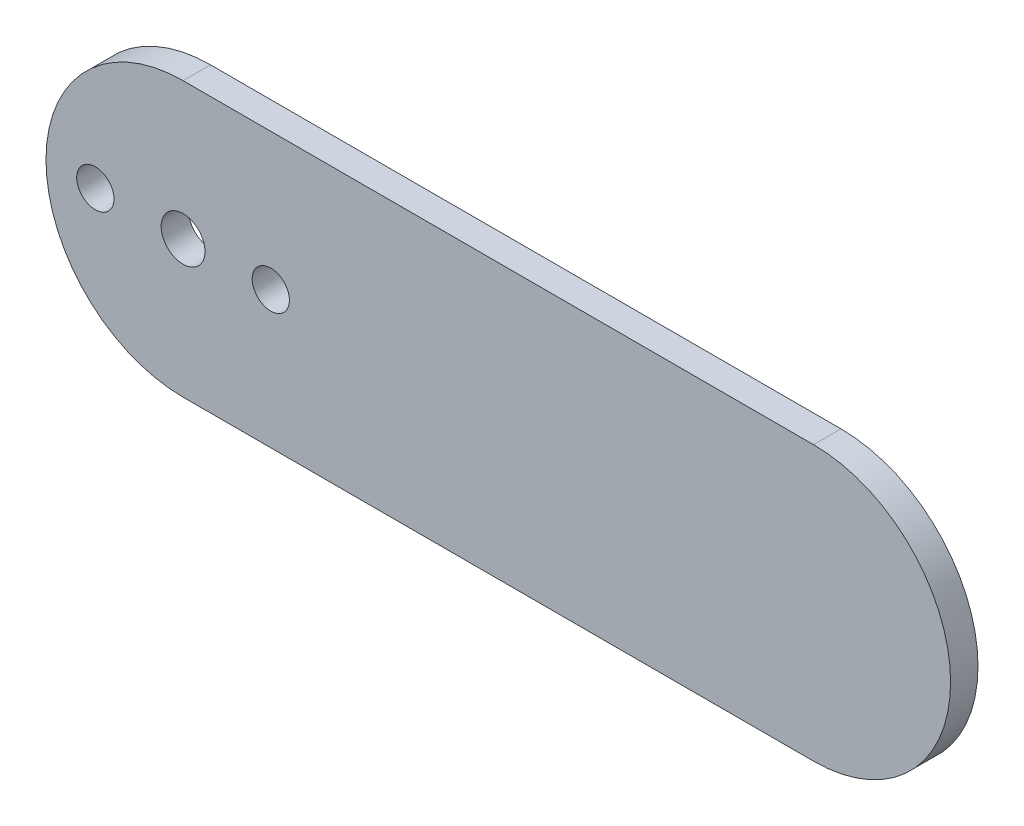
from build123d import *

# Parameters (mm, degrees)
SKETCH2_R           = 4
SKETCH2_R_2         = 3.4
BOSS_EXTRUDE1_DEPTH = 2.5


with BuildPart() as part:
    # Sketch2 → Boss-Extrude1 (new, symmetric)
    with BuildSketch(Plane.XY):
        with BuildLine():
            Line((0, 25), (115, 25))
            ThreePointArc((115, 25), (140, 0), (115, -25))
            Line((115, -25), (0, -25))
            ThreePointArc((0, -25), (-25, 0), (0, 25))
        make_face()
        Circle(SKETCH2_R, mode=Mode.SUBTRACT)
        with Locations((16, 0)):
            Circle(SKETCH2_R_2, mode=Mode.SUBTRACT)
        with Locations((-16, 0)):
            Circle(SKETCH2_R_2, mode=Mode.SUBTRACT)
    extrude(amount=BOSS_EXTRUDE1_DEPTH, both=True)


solid = part.part
